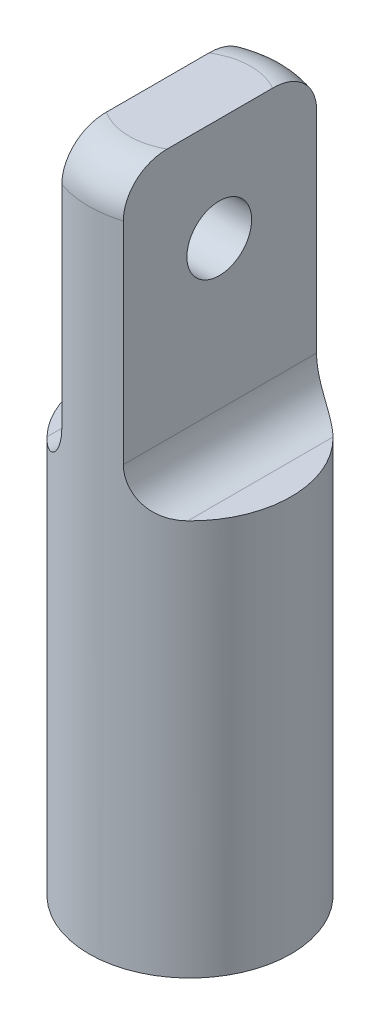
from build123d import *

# Parameters (mm, degrees)
EXTRUDE_START       = -25
SKETCH_1_R          = 12.5
EXTRUDE_1_DEPTH     = 85
SKETCH_2_W          = 12.354431351
SKETCH_2_H          = 42
SKETCH_2_W_2        = 12.054431351
CUT_EXTRUDE_2_DEPTH = 30
FILLET_2_R          = 5
SKETCH_3_R          = 4
CUT_EXTRUDE_1_DEPTH = 64.470465687
FILLET_3_R          = 5


with BuildPart() as part:
    # Эскиз1 → Вытянуть1 (new body)
    with BuildSketch(Plane(origin=(0, 0, 0), x_dir=(1, 0, 0), z_dir=(0, 1, 0)).offset(EXTRUDE_START)):
        with Locations(Location((0, 0, 0), (0, 0, 270))):
            Circle(SKETCH_1_R)
    extrude(amount=EXTRUDE_1_DEPTH)

    # Эскиз2 → Вытянуть2 (cut, symmetric)
    with BuildSketch(Plane.XY):
        with Locations((9.877215676, 44.929871577)):
            Rectangle(SKETCH_2_W, SKETCH_2_H)
        with Locations((-10.027215676, 44.929871577)):
            Rectangle(SKETCH_2_W_2, SKETCH_2_H)
    extrude(amount=CUT_EXTRUDE_2_DEPTH, both=True, mode=Mode.SUBTRACT)

    # Скругление2
    fillet_2_edges = [part.edges().sort_by_distance(p)[0] for p in [
        (-0.157665968, 60, -12.499005618),
        (-2.026821276, 60, 12.33458534),
    ]]
    fillet(fillet_2_edges, radius=FILLET_2_R)

    # Эскиз3 → Вырез-Вытянуть1 (cut, through all)
    with BuildSketch(Plane.ZY.offset(4)):
        with Locations(Location((0.082516108, 47.227633341, 0), (0, 0, 270))):
            Circle(SKETCH_3_R)
    extrude(amount=-CUT_EXTRUDE_1_DEPTH, mode=Mode.SUBTRACT)

    # Скругление3
    fillet_3_edges = [part.edges().sort_by_distance(p)[0] for p in [
        (3.7, 23.929871577, 0),
        (-4, 23.929871577, 0),
    ]]
    fillet(fillet_3_edges, radius=FILLET_3_R)


solid = part.part
